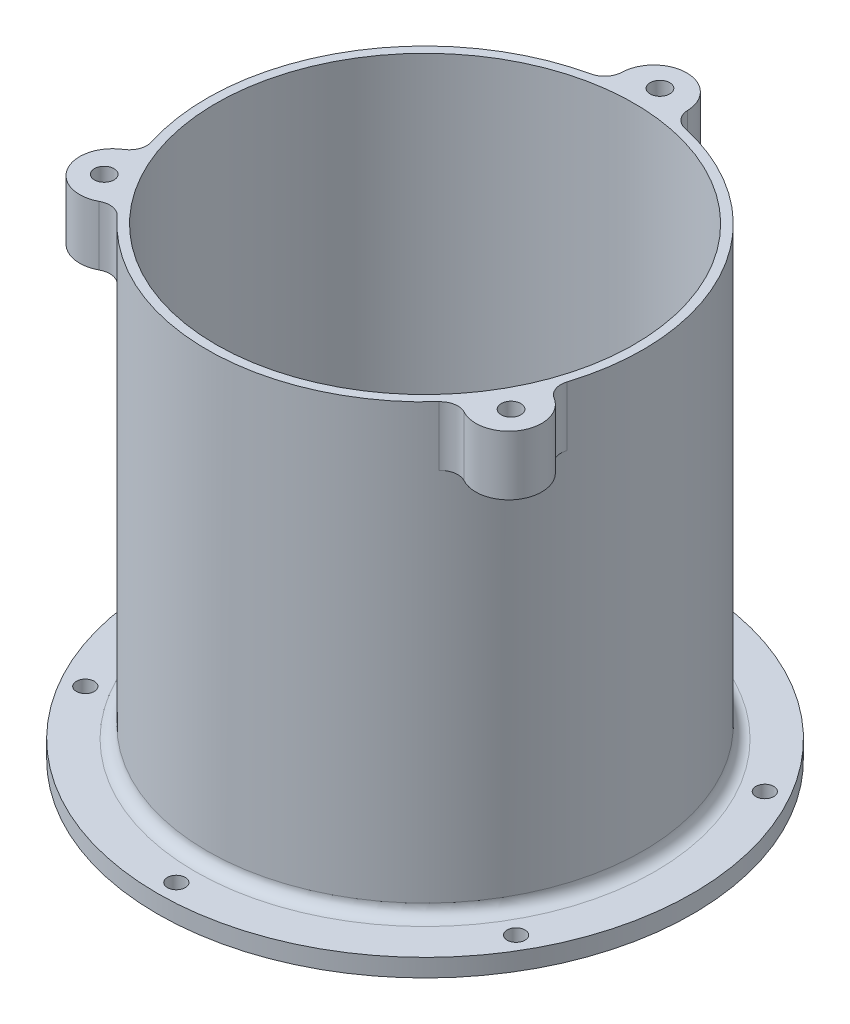
from build123d import *

# Parameters (mm, degrees)
SKETCH3_R           = 45
SKETCH3_R_2         = 35.15
BOSS_EXTRUDE4_DEPTH = 3
SKETCH4_R           = 36.65
SKETCH4_R_2         = 35.15
BOSS_EXTRUDE5_DEPTH = 75
FILLET1_R           = 2
SKETCH7_R           = 1.5
CUT_EXTRUDE2_DEPTH  = 99.361577865
BOSS_EXTRUDE7_START = -10
BOSS_EXTRUDE7_DEPTH = 10
SKETCH9_R           = 1.65
CUT_EXTRUDE3_DEPTH  = 10
FILLET2_R           = 3


with BuildPart() as part:
    # Sketch3 → Boss-Extrude4 (new body)
    with BuildSketch(Plane(origin=(0, 0, 0), x_dir=(1, 0, 0), z_dir=(0, 1, 0))):
        with Locations(Location((0, 0, 0), (0, 0, 270))):
            Circle(SKETCH3_R)
        with Locations(Location((0, 0, 0), (0, 0, 270))):
            Circle(SKETCH3_R_2, mode=Mode.SUBTRACT)
    extrude(amount=BOSS_EXTRUDE4_DEPTH)

    # Sketch4 → Boss-Extrude5 (add)
    with BuildSketch(Plane(origin=(0, 3, 0), x_dir=(1, 0, 0), z_dir=(0, 1, 0))):
        with Locations(Location((0, 0, 0), (0, 0, 270))):
            Circle(SKETCH4_R)
        with Locations(Location((0, 0, 0), (0, 0, 270))):
            Circle(SKETCH4_R_2, mode=Mode.SUBTRACT)
    extrude(amount=BOSS_EXTRUDE5_DEPTH)

    # Fillet1
    fillet1_edges = [part.edges().sort_by_distance(p)[0] for p in [
        (0, 3, -36.65),
    ]]
    fillet(fillet1_edges, radius=FILLET1_R)

    # Sketch7 → Cut-Extrude2 (cut, through all)
    with BuildSketch(Plane(origin=(0, 3, 0), x_dir=(1, 0, 0), z_dir=(0, 1, 0))):
        with Locations(Location((0, 41.825, 0), (0, 0, 270))):
            Circle(SKETCH7_R)
        with Locations(Location((36.221512513, 20.9125, 0), (0, 0, 270))):
            Circle(SKETCH7_R)
        with Locations(Location((36.221512513, -20.9125, 0), (0, 0, 270))):
            Circle(SKETCH7_R)
        with Locations(Location((0, -41.825, 0), (0, 0, 270))):
            Circle(SKETCH7_R)
        with Locations(Location((-36.221512513, -20.9125, 0), (0, 0, 270))):
            Circle(SKETCH7_R)
        with Locations(Location((-36.221512513, 20.9125, 0), (0, 0, 270))):
            Circle(SKETCH7_R)
    extrude(amount=-CUT_EXTRUDE2_DEPTH, mode=Mode.SUBTRACT)

    # Sketch8 → Boss-Extrude7 (add)
    with BuildSketch(Plane(origin=(0, 78, 0), x_dir=(1, 0, 0), z_dir=(0, 1, 0)).offset(BOSS_EXTRUDE7_START)):
        with BuildLine():
            ThreePointArc((-5.10069415, 36.293324719), (0, 36.65), (5.10069415, 36.293324719))
            ThreePointArc((5.10069415, 36.293324719), (0, 44.007131423), (-5.10069415, 36.293324719))
        make_face()
        with BuildLine():
            ThreePointArc((28.88059412, -22.563993071), (38.11129376, -22.003565711), (33.98128827, -13.729331649))
            ThreePointArc((33.98128827, -13.729331649), (31.739831049, -18.325), (28.88059412, -22.563993071))
        make_face()
        with BuildLine():
            ThreePointArc((-33.98128827, -13.729331649), (-38.11129376, -22.003565711), (-28.88059412, -22.563993071))
            ThreePointArc((-28.88059412, -22.563993071), (-31.739831049, -18.325), (-33.98128827, -13.729331649))
        make_face()
    extrude(amount=BOSS_EXTRUDE7_DEPTH)

    # Sketch9 → Cut-Extrude3 (cut)
    with BuildSketch(Plane(origin=(0, 78, 0), x_dir=(1, 0, 0), z_dir=(0, 1, 0))):
        with Locations(Location((0, 39.5, 0), (0, 0, 270))):
            Circle(SKETCH9_R)
        with Locations(Location((34.208003449, -19.75, 0), (0, 0, 270))):
            Circle(SKETCH9_R)
        with Locations(Location((-34.208003449, -19.75, 0), (0, 0, 270))):
            Circle(SKETCH9_R)
    extrude(amount=-CUT_EXTRUDE3_DEPTH, mode=Mode.SUBTRACT)

    # Fillet2
    fillet2_edges = [part.edges().sort_by_distance(p)[0] for p in [
        (28.88059412, 73, 22.563993071),
        (33.98128827, 73, 13.729331649),
        (-33.98128827, 73, 13.729331649),
        (-28.88059412, 73, 22.563993071),
        (5.10069415, 73, -36.293324719),
        (-5.10069415, 73, -36.293324719),
    ]]
    fillet(fillet2_edges, radius=FILLET2_R)


solid = part.part
